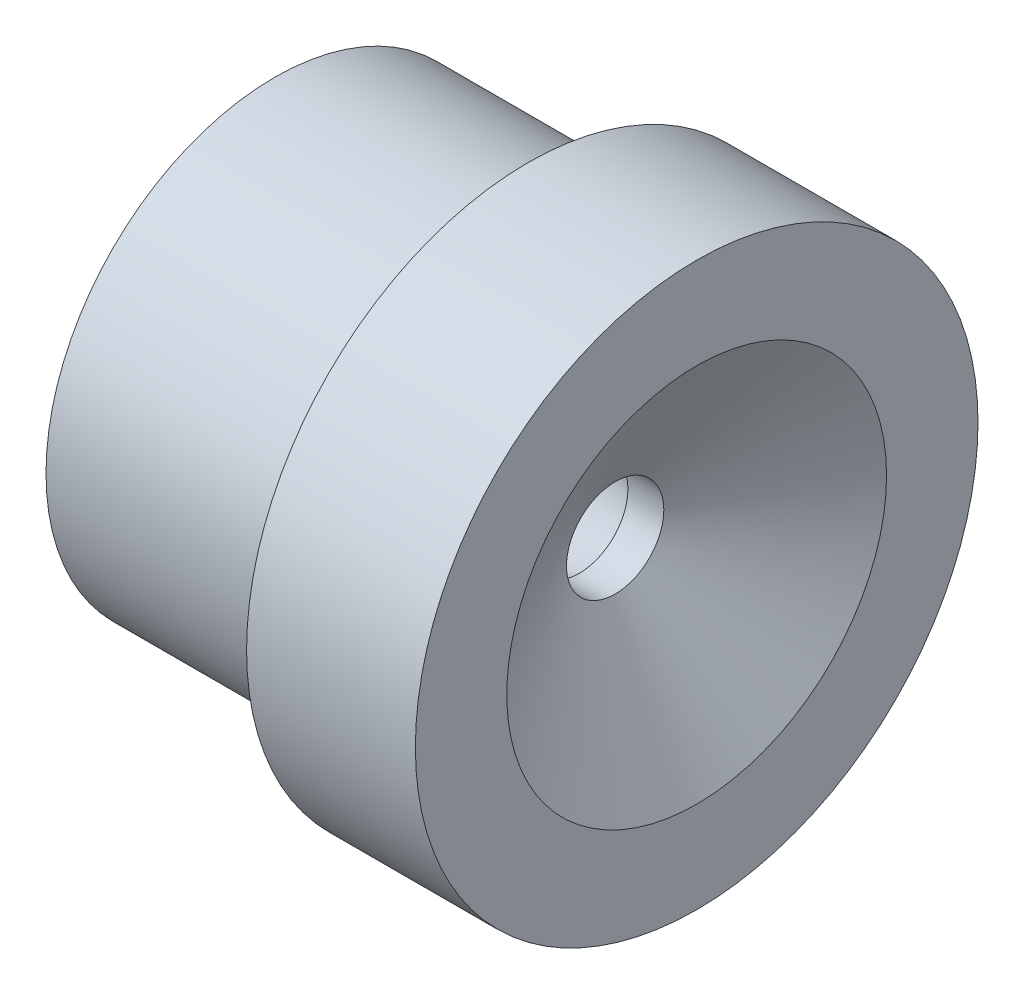
from build123d import *


with BuildPart() as part:
    # Sketch1 → Revolve1 (revolve)
    with BuildSketch(Plane(origin=(0, 0, 0), x_dir=(1, 0, 0), z_dir=(0, 1, 0)), mode=Mode.PRIVATE) as revolve1_sk:
        Polygon((0, 0), (0, 4.1275), (-3.680838906, 10.5029), (-5.301358906, 10.5029), (-19.05, 6.818962722), (-19.05, 2.3749), (-7.62, 2.3749), (-7.62, 0), align=None)
    revolve(revolve1_sk.sketch.rotate(Axis((5.118729701, 0, -12.7), (-1, 0, 0)), 180), axis=Axis((5.118729701, 0, -12.7), (-1, 0, 0)))


solid = part.part
